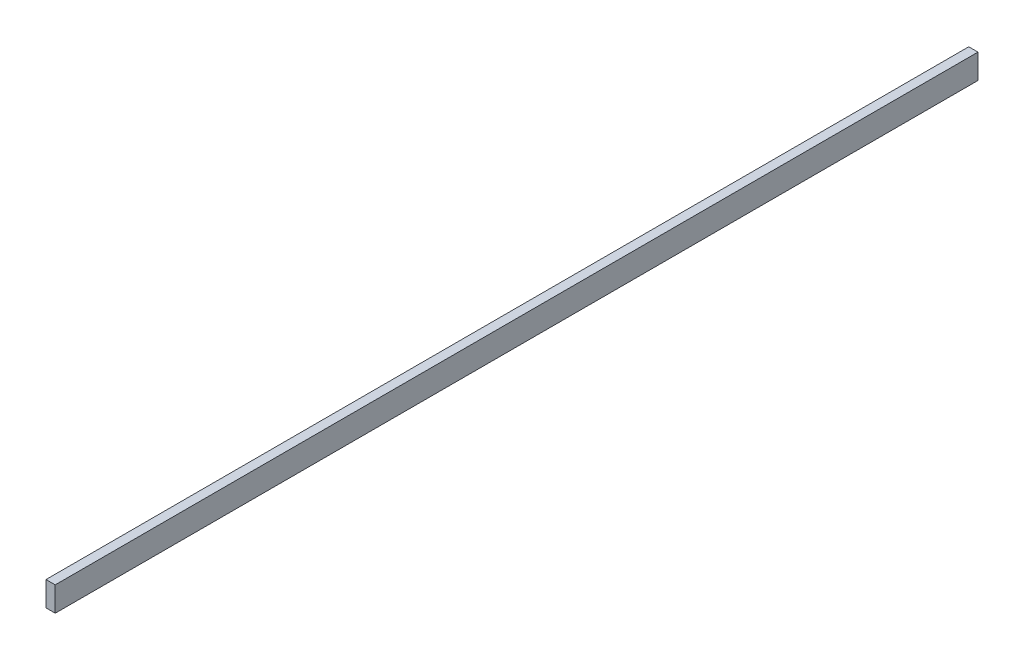
from build123d import *

# Parameters (mm, degrees)
SKETCH1_W           = 75
SKETCH1_H           = 200
BOSS_EXTRUDE1_DEPTH = 7500


with BuildPart() as part:
    # Sketch1 → Boss-Extrude1 (new body)
    with BuildSketch(Plane.XY):
        with Locations((37.5, 100)):
            Rectangle(SKETCH1_W, SKETCH1_H)
    extrude(amount=BOSS_EXTRUDE1_DEPTH)


solid = part.part
